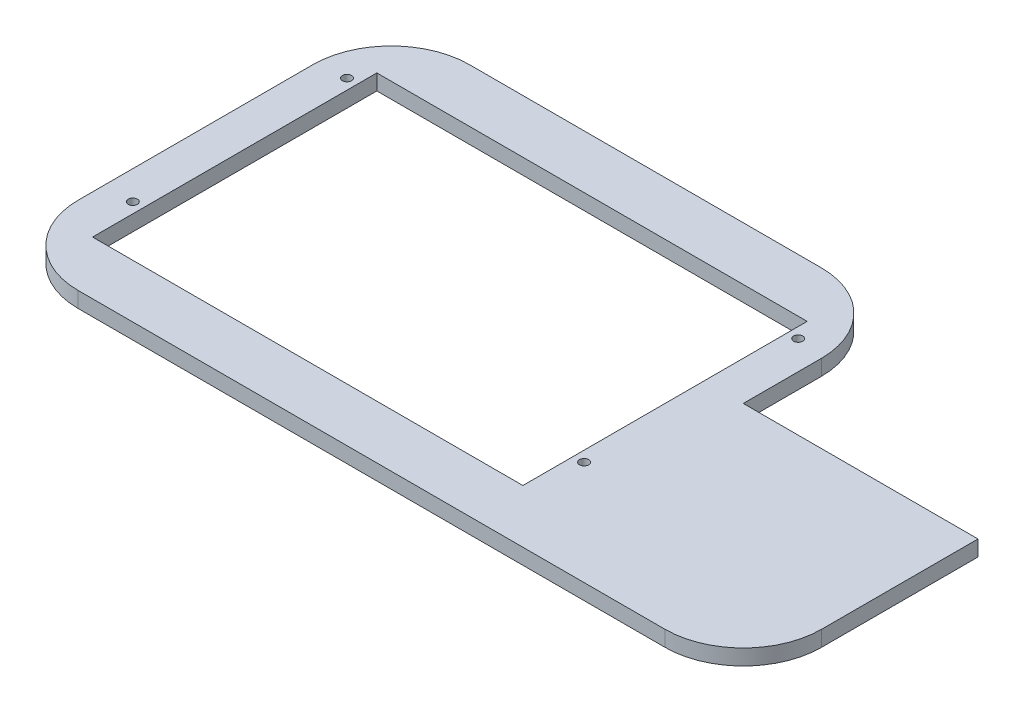
from build123d import *

# Parameters (mm, degrees)
SKETCH1_W           = 165
SKETCH1_H           = 109
BOSS_EXTRUDE1_DEPTH = 6
SKETCH2_R           = 1.75
CUT_EXTRUDE4_DEPTH  = 323.119543027


with BuildPart() as part:
    # Sketch1 → Boss-Extrude1 (new body)
    with BuildSketch(Plane(origin=(0, 0, 0), x_dir=(1, 0, 0), z_dir=(0, 1, 0))):
        with BuildLine():
            Line((30, 150), (165, 150))
            ThreePointArc((165, 150), (186.213203436, 141.213203436), (195, 120))
            Line((195, 120), (195, 90))
            Line((195, 90), (285, 90))
            Line((285, 90), (285, 30))
            ThreePointArc((285, 30), (276.213203436, 8.786796564), (255, 0))
            Line((255, 0), (30, 0))
            ThreePointArc((30, 0), (8.786796564, 8.786796564), (0, 30))
            Line((0, 30), (0, 120))
            ThreePointArc((0, 120), (8.786796564, 141.213203436), (30, 150))
        make_face()
        with Locations((97.5, 75)):
            Rectangle(SKETCH1_W, SKETCH1_H, mode=Mode.SUBTRACT)
    extrude(amount=BOSS_EXTRUDE1_DEPTH)

    # Sketch2 → Cut-Extrude4 (cut, through all)
    with BuildSketch(Plane(origin=(0, 0, 0), x_dir=(1, 0, 0), z_dir=(0, 1, 0))):
        with Locations(Location((184, 122.05, 0), (0, 0, 90))):
            Circle(SKETCH2_R)
        with Locations(Location((11, 122.05, 0), (0, 0, 270))):
            Circle(SKETCH2_R)
        with Locations(Location((184, 39.95, 0), (0, 0, 270))):
            Circle(SKETCH2_R)
        with Locations(Location((11, 39.95, 0), (0, 0, 90))):
            Circle(SKETCH2_R)
    extrude(amount=CUT_EXTRUDE4_DEPTH, mode=Mode.SUBTRACT)


solid = part.part
